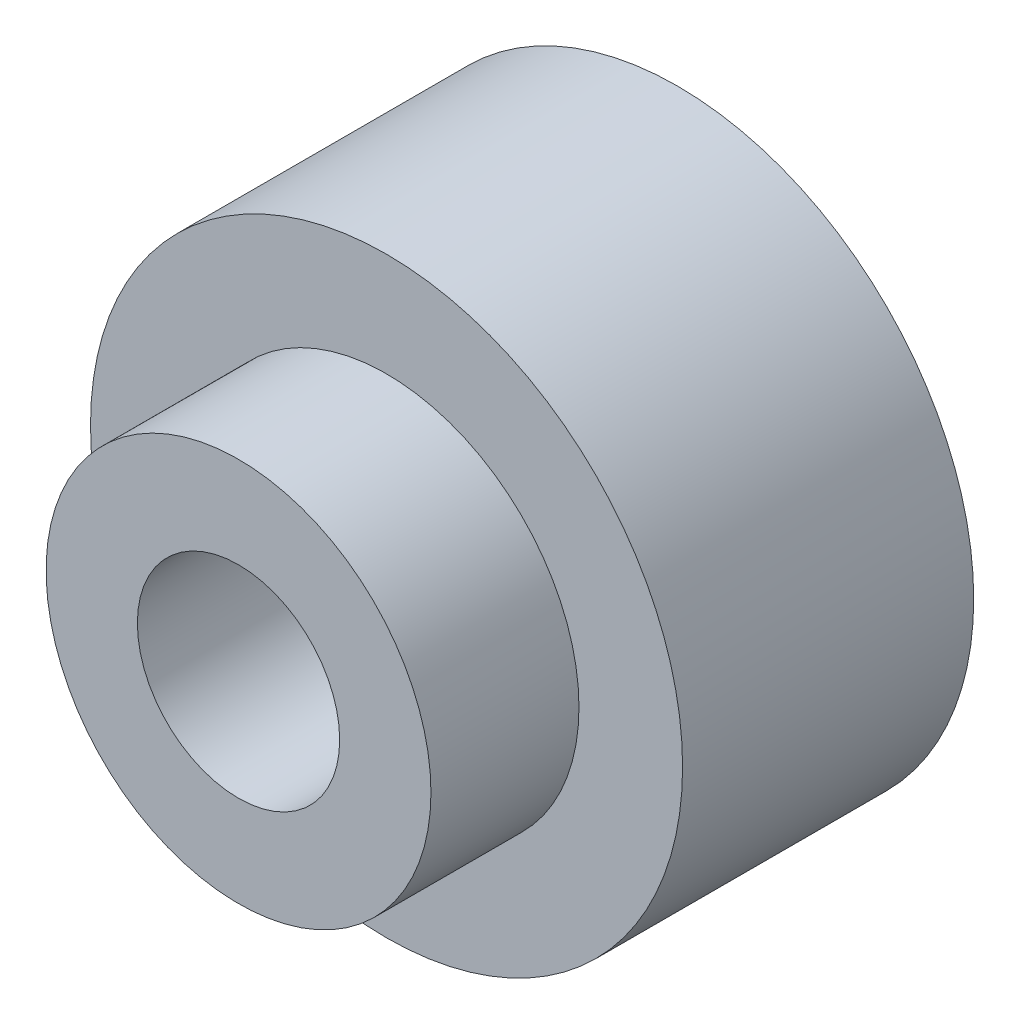
from build123d import *

# Parameters (mm, degrees)
SKETCH1_R           = 6
SKETCH1_R_2         = 2.05
BOSS_EXTRUDE1_DEPTH = 5.9
SKETCH2_R           = 3.9
SKETCH2_R_2         = 2.05
BOSS_EXTRUDE2_DEPTH = 3


with BuildPart() as part:
    # Sketch1 → Boss-Extrude1 (new body)
    with BuildSketch(Plane.XY):
        Circle(SKETCH1_R)
        Circle(SKETCH1_R_2, mode=Mode.SUBTRACT)
    extrude(amount=BOSS_EXTRUDE1_DEPTH)

    # Sketch2 → Boss-Extrude2 (add)
    with BuildSketch(Plane.XY.offset(5.9)):
        Circle(SKETCH2_R)
        Circle(SKETCH2_R_2, mode=Mode.SUBTRACT)
    extrude(amount=BOSS_EXTRUDE2_DEPTH)


solid = part.part
